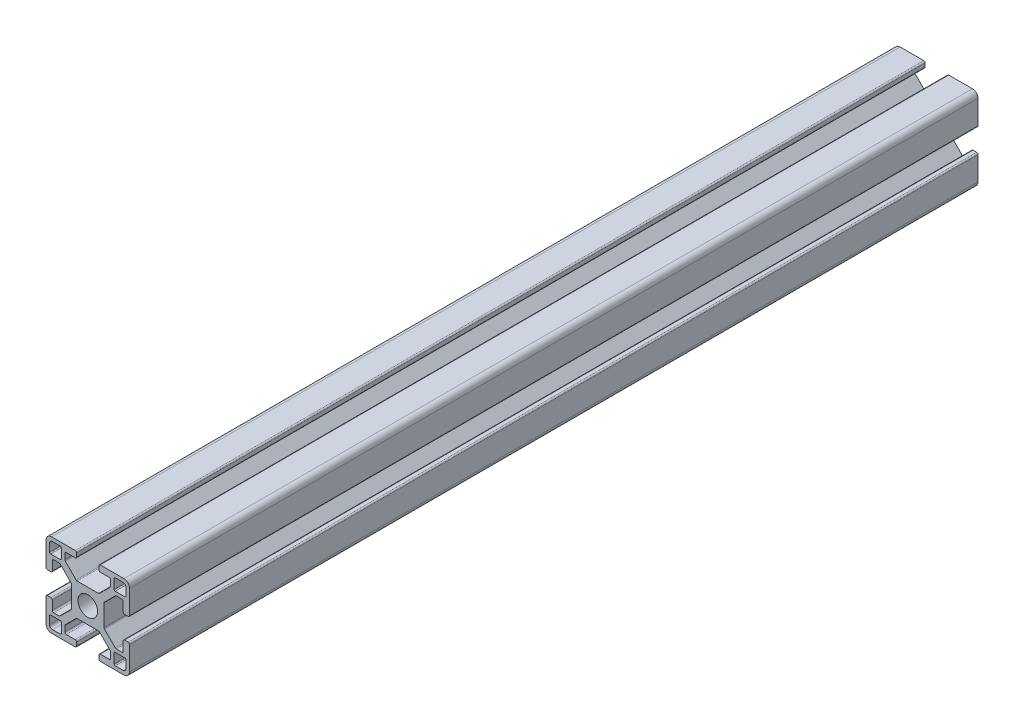
from build123d import *

# Parameters (mm, degrees)
SKETCH1_R           = 3.52998588
BOSS_EXTRUDE1_DEPTH = 152.4


with BuildPart() as part:
    # Sketch1 → Boss-Extrude1 (new, symmetric)
    with BuildSketch(Plane.XY):
        with BuildLine():
            Line((14.49994, -4), (13.24247465, -4))
            ThreePointArc((13.24247465, -4), (12.88892126, -4.146446609), (12.74247465, -4.5))
            Line((12.74247465, -4.5), (12.74247465, -7.732519321))
            ThreePointArc((12.74247465, -7.732519321), (12.602449697, -8.097296796), (12.242781236, -8.249967))
            Line((12.242781236, -8.249967), (10.260188032, -8.249967))
            ThreePointArc((10.260188032, -8.249967), (10.068847082, -8.211906919), (9.906636056, -8.103520976))
            Line((9.906636056, -8.103520976), (5.981117769, -4.178002689))
            ThreePointArc((5.981117769, -4.178002689), (5.872731827, -4.015791664), (5.834671745, -3.824450713))
            Line((5.834671745, -3.824450713), (5.834671745, -1.01249595))
            Line((5.834671745, -1.01249595), (5.834671745, 0.88749645))
            Line((5.834671745, 0.88749645), (5.834671745, 3.824450713))
            ThreePointArc((5.834671745, 3.824450713), (5.872731827, 4.015791664), (5.981117769, 4.178002689))
            Line((5.981117769, 4.178002689), (9.906636056, 8.103520976))
            ThreePointArc((9.906636056, 8.103520976), (10.068847082, 8.211906919), (10.260188032, 8.249967))
            Line((10.260188032, 8.249967), (12.242781236, 8.249967))
            ThreePointArc((12.242781236, 8.249967), (12.602449697, 8.097296796), (12.74247465, 7.732519321))
            Line((12.74247465, 7.732519321), (12.74247465, 4.5))
            ThreePointArc((12.74247465, 4.5), (12.88892126, 4.146446609), (13.24247465, 4))
            Line((13.24247465, 4), (14.49994, 4))
            ThreePointArc((14.49994, 4), (14.853493391, 4.146446609), (14.99994, 4.5))
            Line((14.99994, 4.5), (14.99994, 12.999948))
            ThreePointArc((14.99994, 12.999948), (14.414155906, 14.414155906), (12.999948, 14.99994))
            Line((12.999948, 14.99994), (4.5, 14.99994))
            ThreePointArc((4.5, 14.99994), (4.146446609, 14.853493391), (4, 14.49994))
            Line((4, 14.49994), (4, 13.24247465))
            ThreePointArc((4, 13.24247465), (4.146446609, 12.88892126), (4.5, 12.74247465))
            Line((4.5, 12.74247465), (7.732519321, 12.74247465))
            ThreePointArc((7.732519321, 12.74247465), (8.097296796, 12.602449697), (8.249967, 12.242781236))
            Line((8.249967, 12.242781236), (8.249967, 10.260188032))
            ThreePointArc((8.249967, 10.260188032), (8.211906919, 10.068847082), (8.103520976, 9.906636056))
            Line((8.103520976, 9.906636056), (4.178002689, 5.981117769))
            ThreePointArc((4.178002689, 5.981117769), (4.015791664, 5.872731827), (3.824450713, 5.834671745))
            Line((3.824450713, 5.834671745), (0.9499962, 5.834671745))
            Line((0.9499962, 5.834671745), (-0.9499962, 5.834671745))
            Line((-0.9499962, 5.834671745), (-3.824450713, 5.834671745))
            ThreePointArc((-3.824450713, 5.834671745), (-4.015791664, 5.872731827), (-4.178002689, 5.981117769))
            Line((-4.178002689, 5.981117769), (-8.103520976, 9.906636056))
            ThreePointArc((-8.103520976, 9.906636056), (-8.211906919, 10.068847082), (-8.249967, 10.260188032))
            Line((-8.249967, 10.260188032), (-8.249967, 12.242781236))
            ThreePointArc((-8.249967, 12.242781236), (-8.097296796, 12.602449697), (-7.732519321, 12.74247465))
            Line((-7.732519321, 12.74247465), (-4.5, 12.74247465))
            ThreePointArc((-4.5, 12.74247465), (-4.146446609, 12.88892126), (-4, 13.24247465))
            Line((-4, 13.24247465), (-4, 14.49994))
            ThreePointArc((-4, 14.49994), (-4.146446609, 14.853493391), (-4.5, 14.99994))
            Line((-4.5, 14.99994), (-12.999948, 14.99994))
            ThreePointArc((-12.999948, 14.99994), (-14.414155906, 14.414155906), (-14.99994, 12.999948))
            Line((-14.99994, 12.999948), (-14.99994, 4.5))
            ThreePointArc((-14.99994, 4.5), (-14.853493391, 4.146446609), (-14.49994, 4))
            Line((-14.49994, 4), (-13.24247465, 4))
            ThreePointArc((-13.24247465, 4), (-12.88892126, 4.146446609), (-12.74247465, 4.5))
            Line((-12.74247465, 4.5), (-12.74247465, 7.732519321))
            ThreePointArc((-12.74247465, 7.732519321), (-12.602449697, 8.097296796), (-12.242781236, 8.249967))
            Line((-12.242781236, 8.249967), (-10.260188032, 8.249967))
            ThreePointArc((-10.260188032, 8.249967), (-10.068847082, 8.211906919), (-9.906636056, 8.103520976))
            Line((-9.906636056, 8.103520976), (-5.981117769, 4.178002689))
            ThreePointArc((-5.981117769, 4.178002689), (-5.872731827, 4.015791664), (-5.834671745, 3.824450713))
            Line((-5.834671745, 3.824450713), (-5.834671745, 0.88749645))
            Line((-5.834671745, 0.88749645), (-5.834671745, -1.01249595))
            Line((-5.834671745, -1.01249595), (-5.834671745, -3.824450713))
            ThreePointArc((-5.834671745, -3.824450713), (-5.872731827, -4.015791664), (-5.981117769, -4.178002689))
            Line((-5.981117769, -4.178002689), (-9.906636056, -8.103520976))
            ThreePointArc((-9.906636056, -8.103520976), (-10.068847082, -8.211906919), (-10.260188032, -8.249967))
            Line((-10.260188032, -8.249967), (-12.242781236, -8.249967))
            ThreePointArc((-12.242781236, -8.249967), (-12.602449697, -8.097296796), (-12.74247465, -7.732519321))
            Line((-12.74247465, -7.732519321), (-12.74247465, -4.5))
            ThreePointArc((-12.74247465, -4.5), (-12.88892126, -4.146446609), (-13.24247465, -4))
            Line((-13.24247465, -4), (-14.49994, -4))
            ThreePointArc((-14.49994, -4), (-14.853493391, -4.146446609), (-14.99994, -4.5))
            Line((-14.99994, -4.5), (-14.99994, -12.999948))
            ThreePointArc((-14.99994, -12.999948), (-14.414155906, -14.414155906), (-12.999948, -14.99994))
            Line((-12.999948, -14.99994), (-4.5, -14.99994))
            ThreePointArc((-4.5, -14.99994), (-4.146446609, -14.853493391), (-4, -14.49994))
            Line((-4, -14.49994), (-4, -13.24247465))
            ThreePointArc((-4, -13.24247465), (-4.146446609, -12.88892126), (-4.5, -12.74247465))
            Line((-4.5, -12.74247465), (-7.732519321, -12.74247465))
            ThreePointArc((-7.732519321, -12.74247465), (-8.097296796, -12.602449697), (-8.249967, -12.242781236))
            Line((-8.249967, -12.242781236), (-8.249967, -10.260188032))
            ThreePointArc((-8.249967, -10.260188032), (-8.211906919, -10.068847082), (-8.103520976, -9.906636056))
            Line((-8.103520976, -9.906636056), (-4.178002689, -5.981117769))
            ThreePointArc((-4.178002689, -5.981117769), (-4.015791664, -5.872731827), (-3.824450713, -5.834671745))
            Line((-3.824450713, -5.834671745), (-0.9499962, -5.834671745))
            Line((-0.9499962, -5.834671745), (0.9499962, -5.834671745))
            Line((0.9499962, -5.834671745), (3.824450713, -5.834671745))
            ThreePointArc((3.824450713, -5.834671745), (4.015791664, -5.872731827), (4.178002689, -5.981117769))
            Line((4.178002689, -5.981117769), (8.103520976, -9.906636056))
            ThreePointArc((8.103520976, -9.906636056), (8.211906919, -10.068847082), (8.249967, -10.260188032))
            Line((8.249967, -10.260188032), (8.249967, -12.242781236))
            ThreePointArc((8.249967, -12.242781236), (8.097296796, -12.602449697), (7.732519321, -12.74247465))
            Line((7.732519321, -12.74247465), (4.5, -12.74247465))
            ThreePointArc((4.5, -12.74247465), (4.146446609, -12.88892126), (4, -13.24247465))
            Line((4, -13.24247465), (4, -14.49994))
            ThreePointArc((4, -14.49994), (4.146446609, -14.853493391), (4.5, -14.99994))
            Line((4.5, -14.99994), (12.999948, -14.99994))
            ThreePointArc((12.999948, -14.99994), (14.414155906, -14.414155906), (14.99994, -12.999948))
            Line((14.99994, -12.999948), (14.99994, -4.5))
            ThreePointArc((14.99994, -4.5), (14.853493391, -4.146446609), (14.49994, -4))
        make_face()
        Circle(SKETCH1_R, mode=Mode.SUBTRACT)
        with BuildLine():
            Line((-12.6999492, -13.6999452), (-9.880960476, -13.6999452))
            ThreePointArc((-9.880960476, -13.6999452), (-9.61155387, -13.58835333), (-9.499962, -13.318946724))
            Line((-9.499962, -13.318946724), (-9.499962, -9.87996048))
            ThreePointArc((-9.499962, -9.87996048), (-9.611260978, -9.611260978), (-9.87996048, -9.499962))
            Line((-9.87996048, -9.499962), (-13.318946724, -9.499962))
            ThreePointArc((-13.318946724, -9.499962), (-13.58835333, -9.61155387), (-13.6999452, -9.880960476))
            Line((-13.6999452, -9.880960476), (-13.6999452, -12.6999492))
            ThreePointArc((-13.6999452, -12.6999492), (-13.407053153, -13.407053153), (-12.6999492, -13.6999452))
        make_face(mode=Mode.SUBTRACT)
        with BuildLine():
            Line((13.6999452, -12.6999492), (13.6999452, -9.880960476))
            ThreePointArc((13.6999452, -9.880960476), (13.58835333, -9.61155387), (13.318946724, -9.499962))
            Line((13.318946724, -9.499962), (9.87996048, -9.499962))
            ThreePointArc((9.87996048, -9.499962), (9.611260978, -9.611260978), (9.499962, -9.87996048))
            Line((9.499962, -9.87996048), (9.499962, -13.318946724))
            ThreePointArc((9.499962, -13.318946724), (9.61155387, -13.58835333), (9.880960476, -13.6999452))
            Line((9.880960476, -13.6999452), (12.6999492, -13.6999452))
            ThreePointArc((12.6999492, -13.6999452), (13.407053153, -13.407053153), (13.6999452, -12.6999492))
        make_face(mode=Mode.SUBTRACT)
        with BuildLine():
            Line((9.87996048, 9.499962), (13.318946724, 9.499962))
            ThreePointArc((13.318946724, 9.499962), (13.58835333, 9.61155387), (13.6999452, 9.880960476))
            Line((13.6999452, 9.880960476), (13.6999452, 12.6999492))
            ThreePointArc((13.6999452, 12.6999492), (13.407053153, 13.407053153), (12.6999492, 13.6999452))
            Line((12.6999492, 13.6999452), (9.880960476, 13.6999452))
            ThreePointArc((9.880960476, 13.6999452), (9.61155387, 13.58835333), (9.499962, 13.318946724))
            Line((9.499962, 13.318946724), (9.499962, 9.87996048))
            ThreePointArc((9.499962, 9.87996048), (9.611260978, 9.611260978), (9.87996048, 9.499962))
        make_face(mode=Mode.SUBTRACT)
        with BuildLine():
            Line((-13.6999452, 12.6999492), (-13.6999452, 9.880960476))
            ThreePointArc((-13.6999452, 9.880960476), (-13.58835333, 9.61155387), (-13.318946724, 9.499962))
            Line((-13.318946724, 9.499962), (-9.87996048, 9.499962))
            ThreePointArc((-9.87996048, 9.499962), (-9.611260978, 9.611260978), (-9.499962, 9.87996048))
            Line((-9.499962, 9.87996048), (-9.499962, 13.318946724))
            ThreePointArc((-9.499962, 13.318946724), (-9.61155387, 13.58835333), (-9.880960476, 13.6999452))
            Line((-9.880960476, 13.6999452), (-12.6999492, 13.6999452))
            ThreePointArc((-12.6999492, 13.6999452), (-13.407053153, 13.407053153), (-13.6999452, 12.6999492))
        make_face(mode=Mode.SUBTRACT)
    extrude(amount=BOSS_EXTRUDE1_DEPTH, both=True)


solid = part.part
